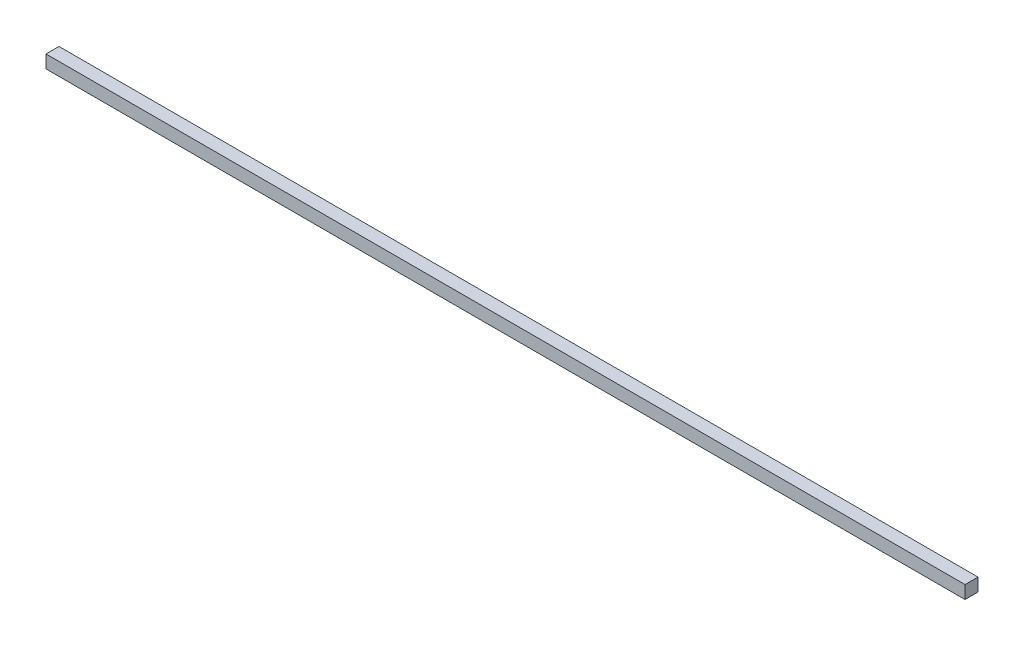
from build123d import *

# Parameters (mm, degrees)
SKETCH1_W           = 245.11
SKETCH1_H           = 3.175
BOSS_EXTRUDE1_DEPTH = 3.175
SKETCH2_W           = 20.32
SKETCH2_H           = 3.175
CUT_EXTRUDE1_DEPTH  = 246.151123493


with BuildPart() as part:
    # Sketch1 → Boss-Extrude1 (new body)
    with BuildSketch(Plane.XY):
        with Locations((122.555, 1.5875)):
            Rectangle(SKETCH1_W, SKETCH1_H)
    extrude(amount=BOSS_EXTRUDE1_DEPTH)

    # Sketch2 → Cut-Extrude1 (cut, through all)
    with BuildSketch(Plane.XY.offset(3.175)):
        with Locations((234.95, 1.5875)):
            Rectangle(SKETCH2_W, SKETCH2_H)
    extrude(amount=-CUT_EXTRUDE1_DEPTH, mode=Mode.SUBTRACT)


solid = part.part
